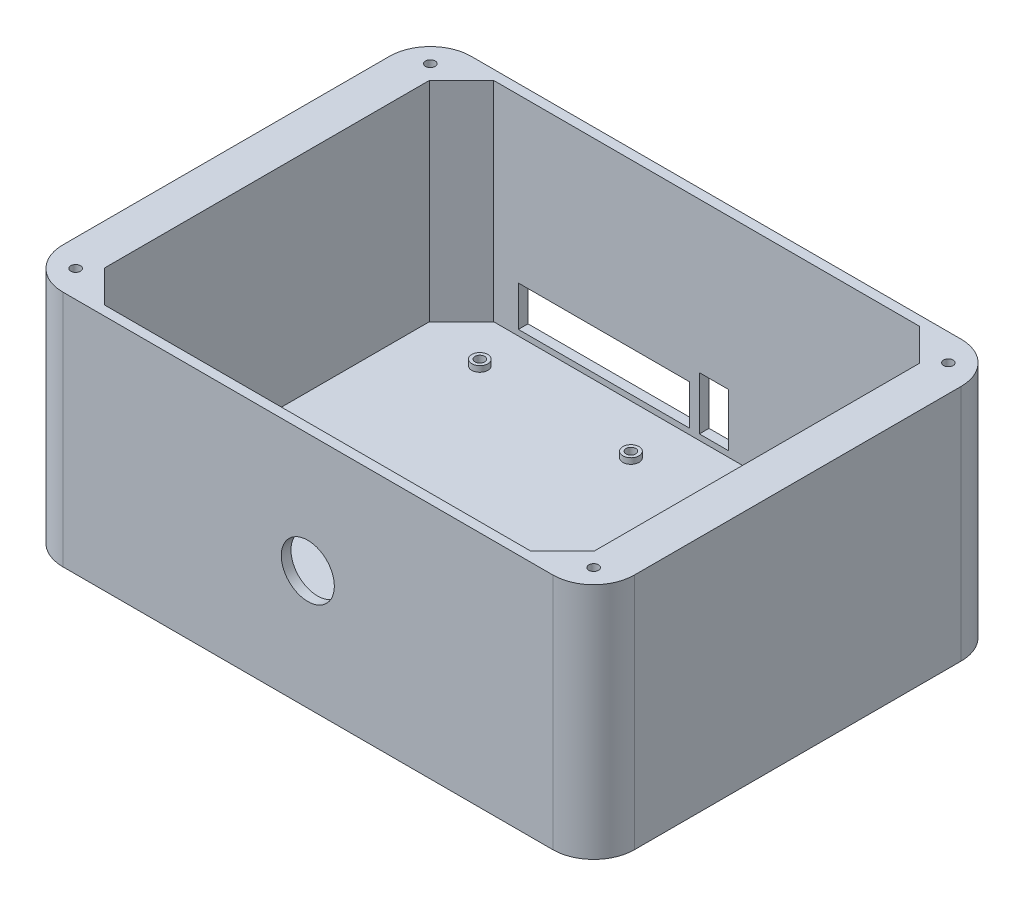
from build123d import *

# Parameters (mm, degrees)
BOSS_EXTRUDE1_DEPTH     = 9
SKETCH2_W               = 152.4
SKETCH2_H               = 121
BOSS_EXTRUDE2_DEPTH     = 65
CHAMFER1_SIZE           = 10
SKETCH3_W               = 53.3
SKETCH3_H               = 12.5
CUT_EXTRUDE1_DEPTH      = 170.573612334
SKETCH4_R               = 2.5
BOSS_EXTRUDE3_DEPTH     = 1.780724539
CUT_EXTRUDE4_DEPTH      = 3
CUT_EXTRUDE4_DEPTH_BACK = 3
SKETCH5_R               = 1.5
CUT_EXTRUDE6_DEPTH      = 3
CUT_EXTRUDE6_DEPTH_BACK = 3
SKETCH7_W               = 9
SKETCH7_H               = 16.5
SKETCH8_R               = 8.25
CUT_EXTRUDE7_DEPTH      = 3
SKETCH9_R               = 1.5
CUT_EXTRUDE8_DEPTH      = 20


with BuildPart() as part:
    # Sketch1 → Boss-Extrude1 (new body)
    with BuildSketch(Plane(origin=(0, 0, 0), x_dir=(1, 0, 0), z_dir=(0, 1, 0))):
        with BuildLine():
            Line((-76.2, 63.5), (76.2, 63.5))
            ThreePointArc((76.2, 63.5), (85.180256121, 59.780256121), (88.9, 50.8))
            Line((88.9, 50.8), (88.9, -50.8))
            ThreePointArc((88.9, -50.8), (85.180256121, -59.780256121), (76.2, -63.5))
            Line((76.2, -63.5), (-76.2, -63.5))
            ThreePointArc((-76.2, -63.5), (-85.180256121, -59.780256121), (-88.9, -50.8))
            Line((-88.9, -50.8), (-88.9, 50.8))
            ThreePointArc((-88.9, 50.8), (-85.180256121, 59.780256121), (-76.2, 63.5))
        make_face()
    extrude(amount=BOSS_EXTRUDE1_DEPTH)

    # Sketch2 → Boss-Extrude2 (add)
    with BuildSketch(Plane(origin=(0, 9, 0), x_dir=(1, 0, 0), z_dir=(0, 1, 0))):
        with BuildLine():
            Line((76.2, 63.5), (-76.2, 63.5))
            ThreePointArc((-76.2, 63.5), (-85.180256121, 59.780256121), (-88.9, 50.8))
            Line((-88.9, 50.8), (-88.9, -50.8))
            ThreePointArc((-88.9, -50.8), (-85.180256121, -59.780256121), (-76.2, -63.5))
            Line((-76.2, -63.5), (76.2, -63.5))
            ThreePointArc((76.2, -63.5), (85.180256121, -59.780256121), (88.9, -50.8))
            Line((88.9, -50.8), (88.9, 50.8))
            ThreePointArc((88.9, 50.8), (85.180256121, 59.780256121), (76.2, 63.5))
        make_face()
        Rectangle(SKETCH2_W, SKETCH2_H, mode=Mode.SUBTRACT)
    extrude(amount=BOSS_EXTRUDE2_DEPTH)

    # Chamfer1
    chamfer1_edges = [part.edges().sort_by_distance(p)[0] for p in [
        (76.2, 41.5, -60.5),
        (-76.2, 41.5, -60.5),
        (-76.2, 41.5, 60.5),
        (76.2, 41.5, 60.5),
    ]]
    chamfer(chamfer1_edges, length=CHAMFER1_SIZE)

    # Sketch3 → Cut-Extrude1 (cut, through all)
    with BuildSketch(Plane.XY.offset(-60.5)):
        with Locations((-31.872362203, 17.030724539)):
            Rectangle(SKETCH3_W, SKETCH3_H)
    extrude(amount=-CUT_EXTRUDE1_DEPTH, mode=Mode.SUBTRACT)

    # Sketch4 → Boss-Extrude3 (add)
    with BuildSketch(Plane(origin=(0, 9, 0), x_dir=(1, 0, 0), z_dir=(0, 1, 0))):
        with Locations(Location((-56.511501143, 46.5, 0), (0, 0, 90))):
            Circle(SKETCH4_R)
        with Locations(Location((-8.211501143, 45.2, 0), (0, 0, 90))):
            Circle(SKETCH4_R)
        with Locations(Location((-23.411501143, -5.6, 0), (0, 0, 90))):
            Circle(SKETCH4_R)
        with Locations(Location((-51.311501143, -5.6, 0), (0, 0, 90))):
            Circle(SKETCH4_R)
    extrude(amount=BOSS_EXTRUDE3_DEPTH)

    # Sketch5 → Cut-Extrude4 (cut, two sides: drawn at the far end of the back side and taken through both)
    with BuildSketch(Plane(origin=(0, 10.780724539, 0), x_dir=(1, 0, 0), z_dir=(0, 1, 0)).offset(-CUT_EXTRUDE4_DEPTH_BACK)):
        with Locations(Location((-23.411501143, -5.6, 0), (0, 0, 270))):
            Circle(SKETCH5_R)
        with Locations(Location((-51.311501143, -5.6, 0), (0, 0, 270))):
            Circle(SKETCH5_R)
        with Locations(Location((-56.511501143, 46.5, 0), (0, 0, 270))):
            Circle(SKETCH5_R)
        with Locations(Location((-8.211501143, 45.2, 0), (0, 0, 270))):
            Circle(SKETCH5_R)
    extrude(amount=CUT_EXTRUDE4_DEPTH + CUT_EXTRUDE4_DEPTH_BACK, mode=Mode.SUBTRACT)

    # Sketch7 → Cut-Extrude6 (cut, two sides: drawn at the far end of the back side and taken through both)
    with BuildSketch(Plane.XY.offset(-60.5).offset(-CUT_EXTRUDE6_DEPTH_BACK)):
        with Locations((2.277637797, 19.030724539)):
            Rectangle(SKETCH7_W, SKETCH7_H)
    extrude(amount=CUT_EXTRUDE6_DEPTH + CUT_EXTRUDE6_DEPTH_BACK, mode=Mode.SUBTRACT)

    # Sketch8 → Cut-Extrude7 (cut)
    with BuildSketch(Plane.XY.offset(63.5)):
        with Locations((0, 37)):
            Circle(SKETCH8_R)
    extrude(amount=-CUT_EXTRUDE7_DEPTH, mode=Mode.SUBTRACT)

    # Sketch9 → Cut-Extrude8 (cut)
    with BuildSketch(Plane(origin=(0, 74, 0), x_dir=(1, 0, 0), z_dir=(0, 1, 0))):
        with Locations(Location((-80.555777772, -55.155777772, 0), (0, 0, 270))):
            Circle(SKETCH9_R)
        with Locations(Location((-80.555777772, 55.155777772, 0), (0, 0, 90))):
            Circle(SKETCH9_R)
        with Locations((29.755777772, -55.155777772)):
            Circle(SKETCH9_R)
        with Locations(Location((80.555777772, 55.155777772, 0), (0, 0, 270))):
            Circle(SKETCH9_R)
        with Locations(Location((80.555777772, -55.155777772, 0), (0, 0, 90))):
            Circle(SKETCH9_R)
    extrude(amount=-CUT_EXTRUDE8_DEPTH, mode=Mode.SUBTRACT)


solid = part.part
